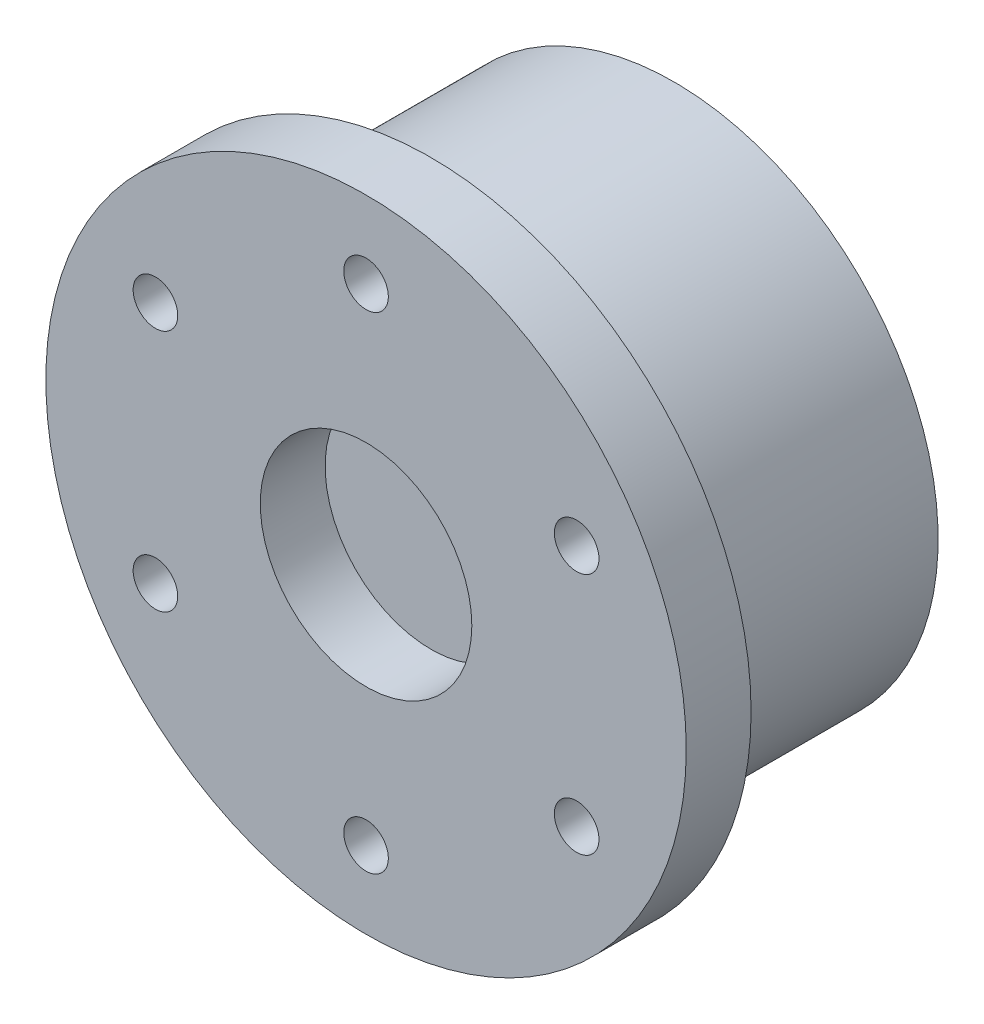
from build123d import *

# Parameters (mm, degrees)
SKETCH1_R           = 39.5
SKETCH1_R_2         = 13.05
BOSS_EXTRUDE1_DEPTH = 8
SKETCH2_R           = 32.575
SKETCH2_R_2         = 2.55
BOSS_EXTRUDE3_DEPTH = 30
SKETCH1_5_R         = 2.75
CUT_EXTRUDE1_DEPTH  = 7


with BuildPart() as part:
    # Sketch1 → Boss-Extrude1 (new body)
    with BuildSketch(Plane.XY):
        Circle(SKETCH1_R)
        Circle(SKETCH1_R_2, mode=Mode.SUBTRACT)
    extrude(amount=-BOSS_EXTRUDE1_DEPTH)

    # Sketch2 → Boss-Extrude3 (add)
    with BuildSketch(Plane(origin=(0, 0, -8), x_dir=(-1, 0, 0), z_dir=(0, 0, -1))):
        Circle(SKETCH2_R)
        with Locations((0, 25)):
            Circle(SKETCH2_R_2, mode=Mode.SUBTRACT)
        with Locations((21.650635095, 12.5)):
            Circle(SKETCH2_R_2, mode=Mode.SUBTRACT)
        with Locations((21.650635095, -12.5)):
            Circle(SKETCH2_R_2, mode=Mode.SUBTRACT)
        with Locations((0, -25)):
            Circle(SKETCH2_R_2, mode=Mode.SUBTRACT)
        with Locations((-21.650635095, -12.5)):
            Circle(SKETCH2_R_2, mode=Mode.SUBTRACT)
        with Locations((-21.650635095, 12.5)):
            Circle(SKETCH2_R_2, mode=Mode.SUBTRACT)
    extrude(amount=BOSS_EXTRUDE3_DEPTH)

    # Sketch1<5> → Cut-Extrude1 (cut)
    with BuildSketch(Plane.XY):
        with Locations((0, 30)):
            Circle(SKETCH1_5_R)
        with Locations((25.980762114, 15)):
            Circle(SKETCH1_5_R)
        with Locations((25.980762114, -15)):
            Circle(SKETCH1_5_R)
        with Locations((0, -30)):
            Circle(SKETCH1_5_R)
        with Locations((-25.980762114, -15)):
            Circle(SKETCH1_5_R)
        with Locations((-25.980762114, 15)):
            Circle(SKETCH1_5_R)
    extrude(amount=-CUT_EXTRUDE1_DEPTH, mode=Mode.SUBTRACT)


solid = part.part
